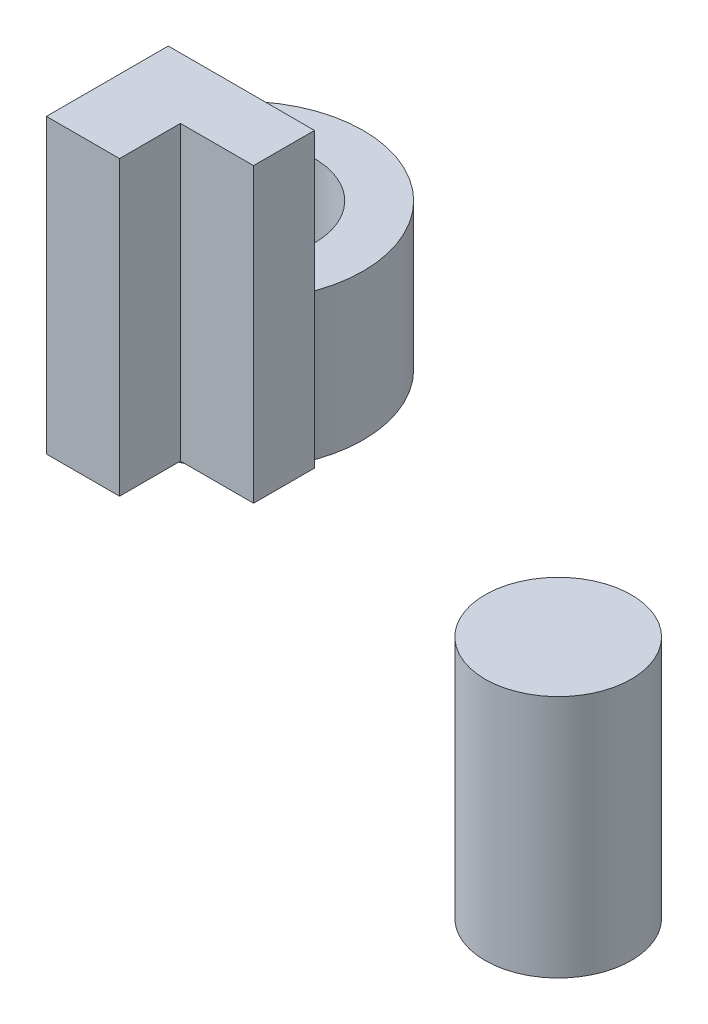
from build123d import *

# Parameters (mm, degrees)
P_IDAT_START            = 40
P_IDAT_VYSUNUT_M1_DEPTH = 60
P_IDAT_START_2          = -15
SKICA2_R                = 15
P_IDAT_VYSUNUT_M2_DEPTH = 50
SKICA4_W                = 10
SKICA4_H                = 30


with BuildPart() as part:
    # Skica1 → Přidat vysunutím1 (new body)
    with BuildSketch(Plane(origin=(0, 0, 0), x_dir=(1, 0, 0), z_dir=(0, 1, 0)).offset(P_IDAT_START)):
        Polygon((50, -35), (20, -35), (20, -60), (35, -60), (35, -47.5), (50, -47.5), align=None)
    extrude(amount=P_IDAT_VYSUNUT_M1_DEPTH)


with BuildPart() as body_2:
    # Skica2 → Přidat vysunutím2 (new body)
    with BuildSketch(Plane(origin=(0, 0, 0), x_dir=(1, 0, 0), z_dir=(0, 1, 0)).offset(P_IDAT_START_2)):
        with Locations(Location((100, -35, 0), (0, 0, 270))):
            Circle(SKICA2_R)
    extrude(amount=P_IDAT_VYSUNUT_M2_DEPTH)


with BuildPart() as body_3:
    # Skica4 → Rotovat1 (revolve)
    with BuildSketch(Plane.XY, mode=Mode.PRIVATE) as rotovat1_sk:
        with Locations((20, 30)):
            Rectangle(SKICA4_W, SKICA4_H)
    revolve(rotovat1_sk.sketch.rotate(Axis((0, 85.855571494, 0), (0, -1, 0)), 90), axis=Axis((0, 85.855571494, 0), (0, -1, 0)))


solid = Compound([part.part, body_2.part, body_3.part])
